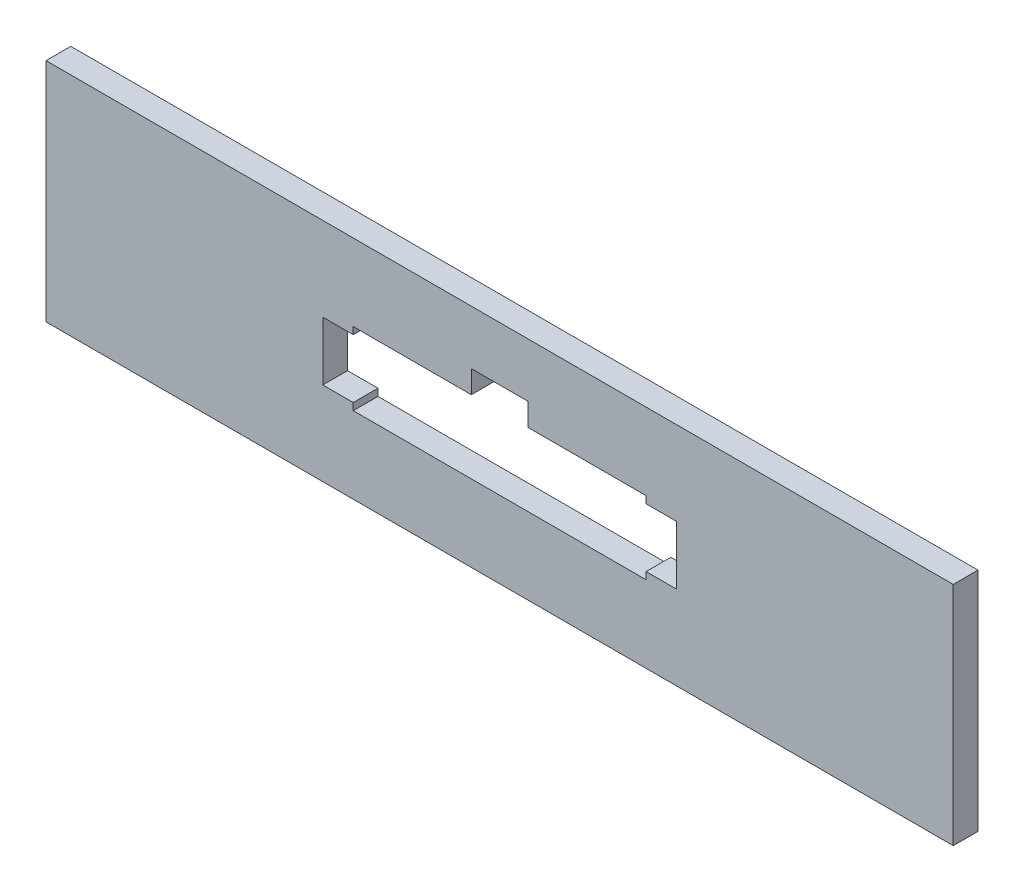
from build123d import *

# Parameters (mm, degrees)
SKETCH1_W           = 64.133812
SKETCH1_H           = 15.995398686
BOSS_EXTRUDE1_DEPTH = 1.75


with BuildPart() as part:
    # Sketch1 → Boss-Extrude1 (new body)
    with BuildSketch(Plane.XY):
        Rectangle(SKETCH1_W, SKETCH1_H)
        Polygon((-12.5, -2.075), (-10.35, -2.075), (-10.35, -2.575), (10.35, -2.575), (10.35, -2.075), (12.5, -2.075), (12.5, 2.075), (10.35, 2.075), (10.35, 2.575), (2, 2.575), (2, 4.175), (-2, 4.175), (-2, 2.575), (-10.35, 2.575), (-10.35, 2.075), (-12.5, 2.075), align=None, mode=Mode.SUBTRACT)
    extrude(amount=BOSS_EXTRUDE1_DEPTH)


solid = part.part
